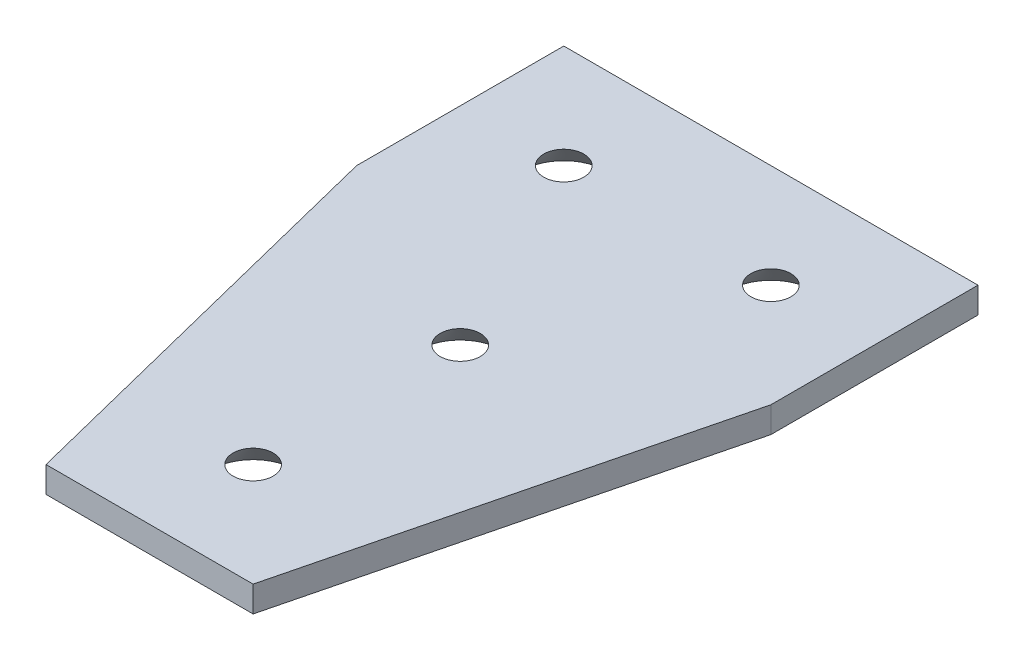
from build123d import *

# Parameters (mm, degrees)
BOSS_EXTRUDE1_DEPTH                   = 3.175
F_10_0_1935_DIAMETER_HOLE1_AT_2_COUNT = 2
F_10_0_1935_DIAMETER_HOLE1_AT_2_PITCH = 25.4
F_10_0_1935_DIAMETER_HOLE1_AT_3_COUNT = 2
F_10_0_1935_DIAMETER_HOLE1_AT_3_PITCH = 28.398063314
F_10_0_1935_DIAMETER_HOLE1_AT_4_COUNT = 2
F_10_0_1935_DIAMETER_HOLE1_AT_4_PITCH = 52.363441445


with BuildPart() as part:
    # Sketch2 → Boss-Extrude1 (new body)
    with BuildSketch(Plane(origin=(0, 0, 0), x_dir=(1, 0, 0), z_dir=(0, 1, 0))):
        Polygon((-0.378728756, 269.21115375), (50.421271244, 269.21115375), (50.421271244, 243.81115375), (37.721271244, 193.01115375), (12.321271244, 193.01115375), (-0.378728756, 243.81115375), align=None)
    extrude(amount=BOSS_EXTRUDE1_DEPTH)

    # Sketch7 → #10 (0.1935) Diameter Hole1 (revolve, cut)
    with BuildSketch(Plane(origin=(37.721271244, 0, -256.51115375), x_dir=(0, 0, -1), z_dir=(1, 0, 0))):
        Polygon((0, 0), (0, 3.175), (2.45745, 3.175), (2.45745, 3.177605133), (5.2197, 0), align=None)
    f_10_0_1935_diameter_hole1 = revolve(axis=Axis((37.721271244, -6.35, -256.51115375), (0, 1, 0)), mode=Mode.SUBTRACT)

    # #10 (0.1935) Diameter Hole1 at 2: #10 (0.1935) Diameter Hole1 ×2
    with Locations(*[(-i * F_10_0_1935_DIAMETER_HOLE1_AT_2_PITCH, 0, 0) for i in range(1, F_10_0_1935_DIAMETER_HOLE1_AT_2_COUNT)]):
        add(f_10_0_1935_diameter_hole1, mode=Mode.SUBTRACT)

    # #10 (0.1935) Diameter Hole1 at 3: #10 (0.1935) Diameter Hole1 ×2
    with Locations(*[Vector(-0.44721359549995443, 0, 0.8944271909999176) * (i * F_10_0_1935_DIAMETER_HOLE1_AT_3_PITCH) for i in range(1, F_10_0_1935_DIAMETER_HOLE1_AT_3_COUNT)]):
        add(f_10_0_1935_diameter_hole1, mode=Mode.SUBTRACT)

    # #10 (0.1935) Diameter Hole1 at 4: #10 (0.1935) Diameter Hole1 ×2
    with Locations(*[Vector(-0.24253562503633175, 0, 0.9701425001453322) * (i * F_10_0_1935_DIAMETER_HOLE1_AT_4_PITCH) for i in range(1, F_10_0_1935_DIAMETER_HOLE1_AT_4_COUNT)]):
        add(f_10_0_1935_diameter_hole1, mode=Mode.SUBTRACT)


solid = part.part
